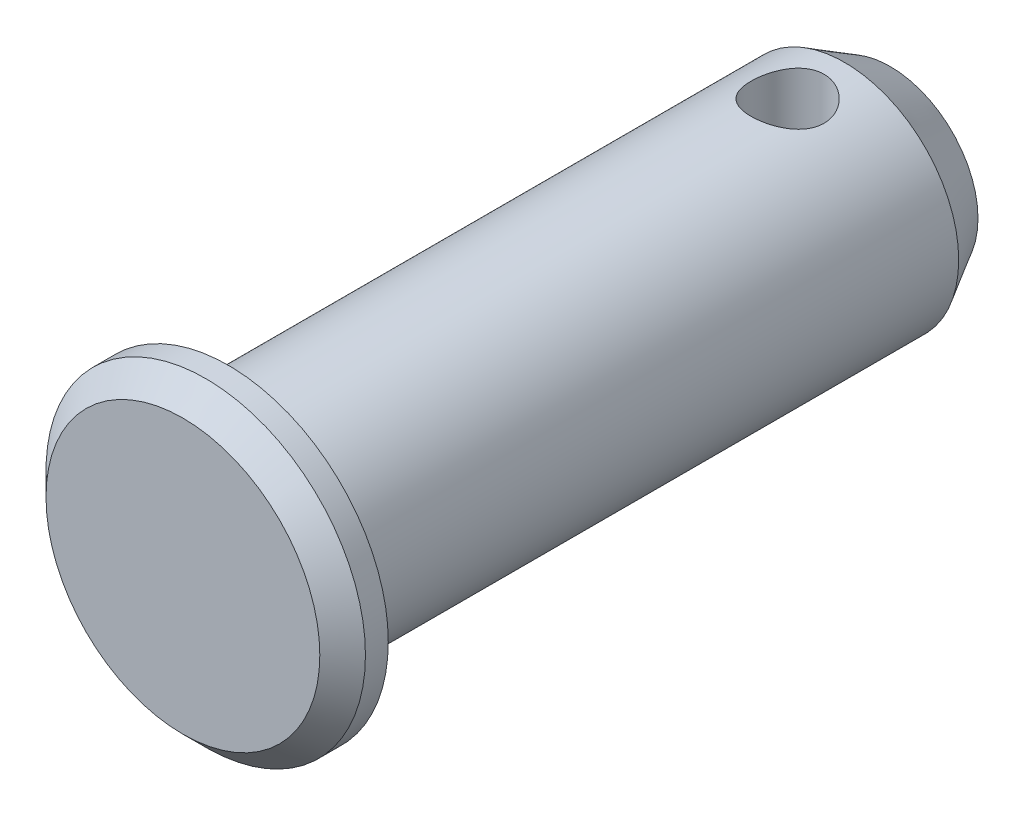
from build123d import *

# Parameters (mm, degrees)
WYTNIJ_WYCI_GNI_CIE1_DEPTH      = 19.391574158
WYTNIJ_WYCI_GNI_CIE1_DEPTH_BACK = 19.391574158
SZKIC2_R                        = 1.6


with BuildPart() as part:
    # Szkic1 → Obrót1 (revolve)
    with BuildSketch(Plane(origin=(0, 0, 0), x_dir=(1, 0, 0), z_dir=(0, 1, 0))):
        Polygon((0, -15.5), (6, -15.5), (7, -14.5), (7, -13.5), (5, -13.5), (5, 13.5), (3.845299462, 15.5), (0, 15.5), align=None)
    revolve(axis=Axis((0, 0, 15.5), (0, 0, -1)))

    # Szkic2 → Wytnij-wyciągnięcie1 (cut, two sides: drawn at the far end of the back side and taken through both)
    with BuildSketch(Plane(origin=(0, 0, 0), x_dir=(1, 0, 0), z_dir=(0, 1, 0)).offset(-WYTNIJ_WYCI_GNI_CIE1_DEPTH_BACK)):
        with Locations(Location((0, 11, 0), (0, 0, 270))):
            Circle(SZKIC2_R)
    extrude(amount=WYTNIJ_WYCI_GNI_CIE1_DEPTH + WYTNIJ_WYCI_GNI_CIE1_DEPTH_BACK, mode=Mode.SUBTRACT)


solid = part.part
